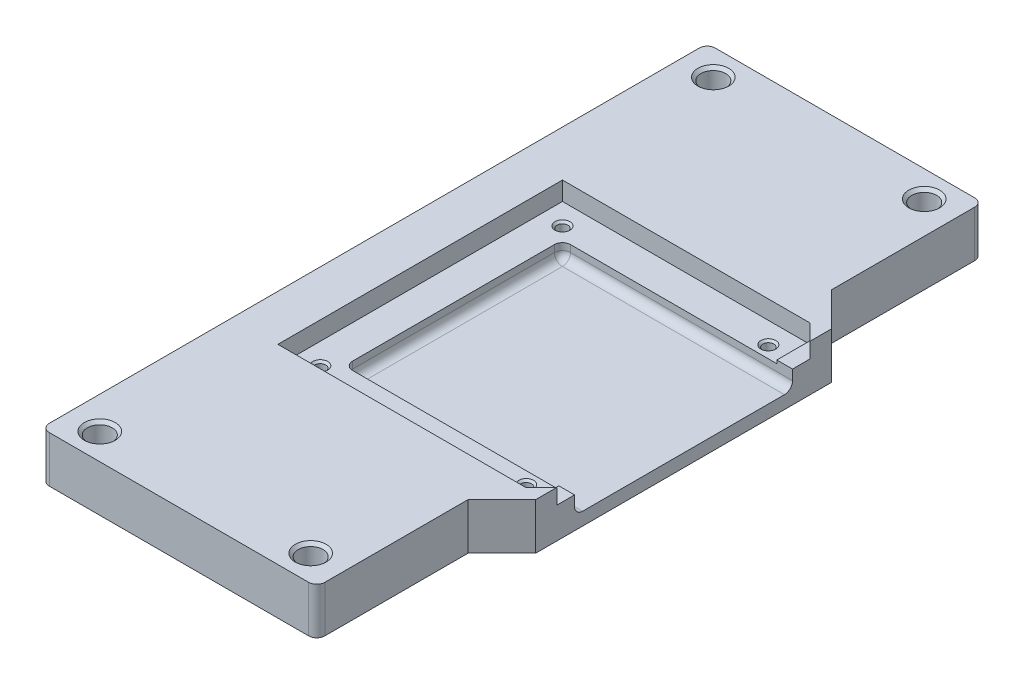
from build123d import *

# Parameters (mm, degrees)
BOSS_EXTRUDE1_DEPTH     = 11.5
SKETCH4_R               = 3.075
CUT_EXTRUDE1_DEPTH      = 6
BOSS_EXTRUDE3_DEPTH     = 11.5
CUT_EXTRUDE6_DEPTH      = 4.6
CUT_EXTRUDE3_DEPTH      = 94.059712013
CUT_EXTRUDE3_DEPTH_BACK = 3.7
SKETCH24_W              = 57
SKETCH24_H              = 54
SKETCH25_R              = 1.35
CUT_EXTRUDE4_DEPTH      = 5
CHAMFER4_SIZE           = 0.5
FILLET1_R               = 2
BOSS_EXTRUDE2_DEPTH     = 0.8
CHAMFER5_SIZE           = 0.75


with BuildPart() as part:
    # Sketch1 → Boss-Extrude1 (new body)
    with BuildSketch(Plane(origin=(0, 0, 0), x_dir=(1, 0, 0), z_dir=(0, 1, 0))):
        with BuildLine():
            Line((-34.125, 67.5), (-34.125, -67.5))
            Line((-34.125, -67.5), (-34.125, -80.5))
            ThreePointArc((-34.125, -80.5), (-33.539213562, -81.914213562), (-32.125, -82.5))
            Line((-32.125, -82.5), (32.125, -82.5))
            ThreePointArc((32.125, -82.5), (33.539213562, -81.914213562), (34.125, -80.5))
            Line((34.125, -80.5), (34.125, -67.5))
            Line((34.125, -67.5), (34.125, 67.5))
            Line((34.125, 67.5), (34.125, 80.5))
            ThreePointArc((34.125, 80.5), (33.539213562, 81.914213562), (32.125, 82.5))
            Line((32.125, 82.5), (-32.125, 82.5))
            ThreePointArc((-32.125, 82.5), (-33.539213562, 81.914213562), (-34.125, 80.5))
            Line((-34.125, 80.5), (-34.125, 67.5))
        make_face()
    extrude(amount=BOSS_EXTRUDE1_DEPTH)

    # Sketch4 → Cut-Extrude1 (cut)
    with BuildSketch(Plane(origin=(0, 11.5, 0), x_dir=(1, 0, 0), z_dir=(0, 1, 0))):
        with Locations(Location((-26.125, -76, 0), (0, 0, 270))):
            Circle(SKETCH4_R)
        with Locations(Location((26.125, -76, 0), (0, 0, 270))):
            Circle(SKETCH4_R)
        with Locations(Location((26.125, 76, 0), (0, 0, 270))):
            Circle(SKETCH4_R)
        with Locations(Location((-26.125, 76, 0), (0, 0, 270))):
            Circle(SKETCH4_R)
    extrude(amount=-CUT_EXTRUDE1_DEPTH, mode=Mode.SUBTRACT)

    # Sketch27 → Boss-Extrude3 (add)
    with BuildSketch(Plane(origin=(0, 11.5, 0), x_dir=(1, 0, 0), z_dir=(0, 1, 0))):
        Polygon((34.125, 45), (42.5, 36.625), (42.5, -36.625), (34.125, -45), align=None)
    extrude(amount=-BOSS_EXTRUDE3_DEPTH)

    # Sketch21 → Cut-Extrude6 (cut)
    with BuildSketch(Plane(origin=(0, 11.5, 0), x_dir=(1, 0, 0), z_dir=(0, 1, 0))):
        Polygon((42.5, 31.353553391), (42.5, -31.353553391), (38.603553391, -35.25), (-22.75, -35.25), (-22.75, 35.25), (38.603553391, 35.25), align=None)
    extrude(amount=-CUT_EXTRUDE6_DEPTH, mode=Mode.SUBTRACT)

    # Sketch24 → Cut-Extrude3 (cut, two sides: drawn at the far end of the back side and taken through both)
    with BuildSketch(Plane(origin=(0, 6.9, 0), x_dir=(1, 0, 0), z_dir=(0, 1, 0)).offset(-CUT_EXTRUDE3_DEPTH_BACK)):
        with Locations((14, 0)):
            Rectangle(SKETCH24_W, SKETCH24_H)
    extrude(amount=CUT_EXTRUDE3_DEPTH + CUT_EXTRUDE3_DEPTH_BACK, mode=Mode.SUBTRACT)

    # Sketch25 → Cut-Extrude4 (cut)
    with BuildSketch(Plane(origin=(0, 6.9, 0), x_dir=(1, 0, 0), z_dir=(0, 1, 0))):
        with Locations(Location((33.5, 30, 0), (0, 0, 270))):
            Circle(SKETCH25_R)
        with Locations(Location((-17.5, 30, 0), (0, 0, 270))):
            Circle(SKETCH25_R)
        with Locations(Location((33.5, -30, 0), (0, 0, 270))):
            Circle(SKETCH25_R)
        with Locations(Location((-17.5, -30, 0), (0, 0, 270))):
            Circle(SKETCH25_R)
    extrude(amount=-CUT_EXTRUDE4_DEPTH, mode=Mode.SUBTRACT)

    # Chamfer4
    chamfer4_edges = [part.edges().sort_by_distance(p)[0] for p in [
        (-17.5, 6.9, -31.35),
        (33.5, 6.9, 28.65),
        (-17.5, 6.9, 28.65),
        (33.5, 6.9, -31.35),
    ]]
    chamfer(chamfer4_edges, length=CHAMFER4_SIZE)

    # Fillet1
    fillet1_edges = [part.edges().sort_by_distance(p)[0] for p in [
        (14, 3.2, -27),
        (-14.5, 5.05, -27),
        (-14.5, 3.2, 0),
        (-14.5, 5.05, 27),
        (14, 3.2, 27),
    ]]
    fillet(fillet1_edges, radius=FILLET1_R)

    # Sketch26 → Boss-Extrude2 (add)
    with BuildSketch(Plane(origin=(0, 6.9, 0), x_dir=(1, 0, 0), z_dir=(0, 1, 0))):
        Polygon((38.603553391, 35.25), (38.603553391, 27), (42.5, 27), (42.5, 31.353553391), align=None)
        Polygon((42.5, -31.353553391), (38.603553391, -35.25), (38.603553391, -27), (42.5, -27), align=None)
    extrude(amount=BOSS_EXTRUDE2_DEPTH)

    # Chamfer5
    chamfer5_edges = [part.edges().sort_by_distance(p)[0] for p in [
        (-26.125, 11.5, -79.075),
        (26.125, 11.5, -79.075),
        (26.125, 11.5, 72.925),
        (-26.125, 11.5, 72.925),
    ]]
    chamfer(chamfer5_edges, length=CHAMFER5_SIZE)


solid = part.part
